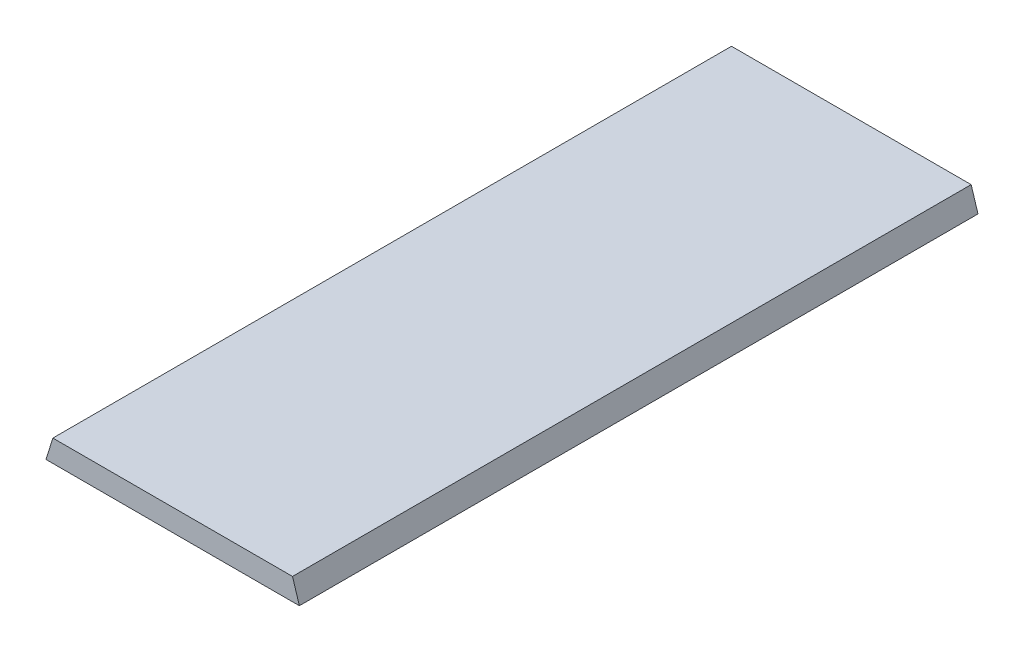
from build123d import *

# Parameters (mm, degrees)
BOSS_EXTRUDE1_DEPTH = 52.5


with BuildPart() as part:
    # Sketch1 → Boss-Extrude1 (new body)
    with BuildSketch(Plane.XY):
        Polygon((-9.8, 0), (9.8, 0), (9.270055911, 1.7), (-9.270055911, 1.7), align=None)
    extrude(amount=-BOSS_EXTRUDE1_DEPTH)


solid = part.part
